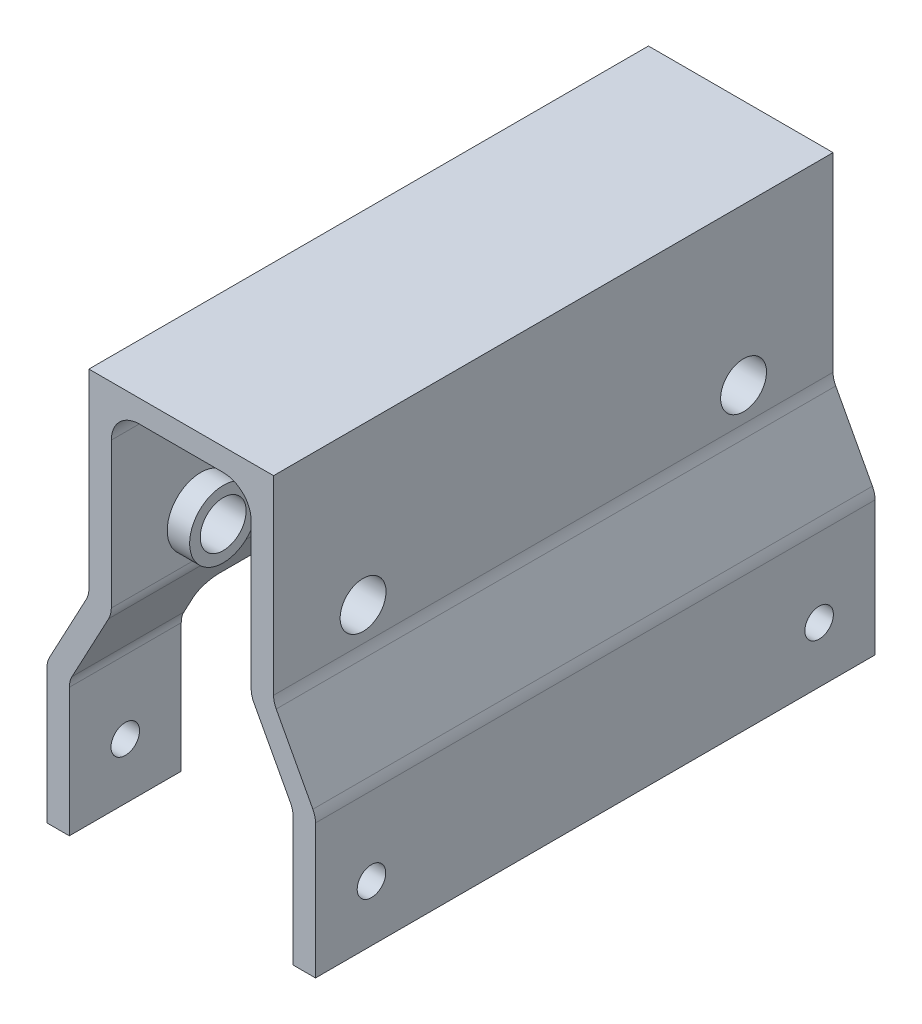
from build123d import *

# Parameters (mm, degrees)
BOSS_EXTRUDE1_DEPTH     = 100
SKETCH3_R               = 6
BOSS_EXTRUDE2_DEPTH     = 4
BOSS_EXTRUDE3_START     = 4
SKETCH4_R               = 6
BOSS_EXTRUDE3_DEPTH     = 4
CUT_EXTRUDE1_DEPTH      = 130.646635128
CUT_EXTRUDE1_DEPTH_BACK = 130.646635128
SKETCH9_R               = 4.1
CUT_EXTRUDE2_DEPTH      = 134.341666406
CUT_EXTRUDE2_DEPTH_BACK = 134.341666406
SKETCH10_R              = 2.55
SKETCH13_W              = 60
SKETCH13_H              = 31.00370213
CUT_EXTRUDE5_DEPTH      = 24
FILLET1_R               = 3
FILLET2_R               = 5
FILLET3_R               = 4


with BuildPart() as part:
    # Sketch2 → Boss-Extrude1 (new body)
    with BuildSketch(Plane.XY):
        Polygon((0, 0), (0, 23.99629787), (7.5, 38), (7.5, 70), (32.5, 70), (32.5, 38), (40, 23.99629787), (40, 0), (44, 0), (44, 25), (36.5, 39.00370213), (36.5, 74), (3.5, 74), (3.5, 39.00370213), (-4, 25), (-4, 0), align=None)
    extrude(amount=BOSS_EXTRUDE1_DEPTH)

    # Sketch3 → Boss-Extrude2 (add)
    with BuildSketch(Plane.ZY.offset(-32.5)):
        with Locations(Location((84, 46, 0), (0, 0, 90))):
            Circle(SKETCH3_R)
        with Locations(Location((16, 46, 0), (0, 0, 90))):
            Circle(SKETCH3_R)
    extrude(amount=BOSS_EXTRUDE2_DEPTH)

    # Sketch4 → Boss-Extrude3 (add)
    with BuildSketch(Plane(origin=(7.5, 0, 0), x_dir=(0, 0, -1), z_dir=(1, 0, 0)).offset(BOSS_EXTRUDE3_START)):
        with Locations(Location((-16, 46, 0), (0, 0, 90))):
            Circle(SKETCH4_R)
        with Locations(Location((-84, 46, 0), (0, 0, 90))):
            Circle(SKETCH4_R)
    extrude(amount=-BOSS_EXTRUDE3_DEPTH)

    # Sketch9 → Cut-Extrude1 (cut, two sides: drawn at the far end of the back side and taken through both)
    with BuildSketch(Plane(origin=(7.5, 0, 0), x_dir=(0, 0, -1), z_dir=(1, 0, 0)).offset(-CUT_EXTRUDE1_DEPTH_BACK)):
        with Locations((-16, 46)):
            Circle(SKETCH9_R)
        with Locations((-84, 46)):
            Circle(SKETCH9_R)
    extrude(amount=CUT_EXTRUDE1_DEPTH + CUT_EXTRUDE1_DEPTH_BACK, mode=Mode.SUBTRACT)

    # Sketch10 → Cut-Extrude2 (cut, two sides: drawn at the far end of the back side and taken through both)
    with BuildSketch(Plane(origin=(44, 0, 0), x_dir=(0, 0, -1), z_dir=(1, 0, 0)).offset(-CUT_EXTRUDE2_DEPTH_BACK)):
        with Locations(Location((-10, 10, 0), (0, 0, 90))):
            Circle(SKETCH10_R)
        with Locations(Location((-90, 10, 0), (0, 0, 90))):
            Circle(SKETCH10_R)
    extrude(amount=CUT_EXTRUDE2_DEPTH + CUT_EXTRUDE2_DEPTH_BACK, mode=Mode.SUBTRACT)

    # Sketch13 → Cut-Extrude5 (cut)
    with BuildSketch(Plane.ZY.offset(4)):
        with Locations((50, 15.501851065)):
            Rectangle(SKETCH13_W, SKETCH13_H)
    extrude(amount=-CUT_EXTRUDE5_DEPTH, mode=Mode.SUBTRACT)

    # Fillet1
    fillet1_edges = [part.edges().sort_by_distance(p)[0] for p in [
        (1.48419643, 31.00370213, 20),
        (1.48419643, 31.00370213, 80),
    ]]
    fillet(fillet1_edges, radius=FILLET1_R)

    # Fillet2
    fillet2_edges = [part.edges().sort_by_distance(p)[0] for p in [
        (32.5, 70, 50),
        (7.5, 70, 50),
    ]]
    fillet(fillet2_edges, radius=FILLET2_R)

    # Fillet3
    fillet3_edges = [part.edges().sort_by_distance(p)[0] for p in [
        (-4, 25, 10),
        (0, 23.99629787, 10),
        (-4, 25, 90),
        (3.5, 39.00370213, 50),
        (36.5, 39.00370213, 50),
        (44, 25, 50),
        (40, 23.99629787, 50),
        (32.5, 38, 50),
        (7.5, 38, 50),
        (0, 23.99629787, 90),
    ]]
    fillet(fillet3_edges, radius=FILLET3_R)


solid = part.part
